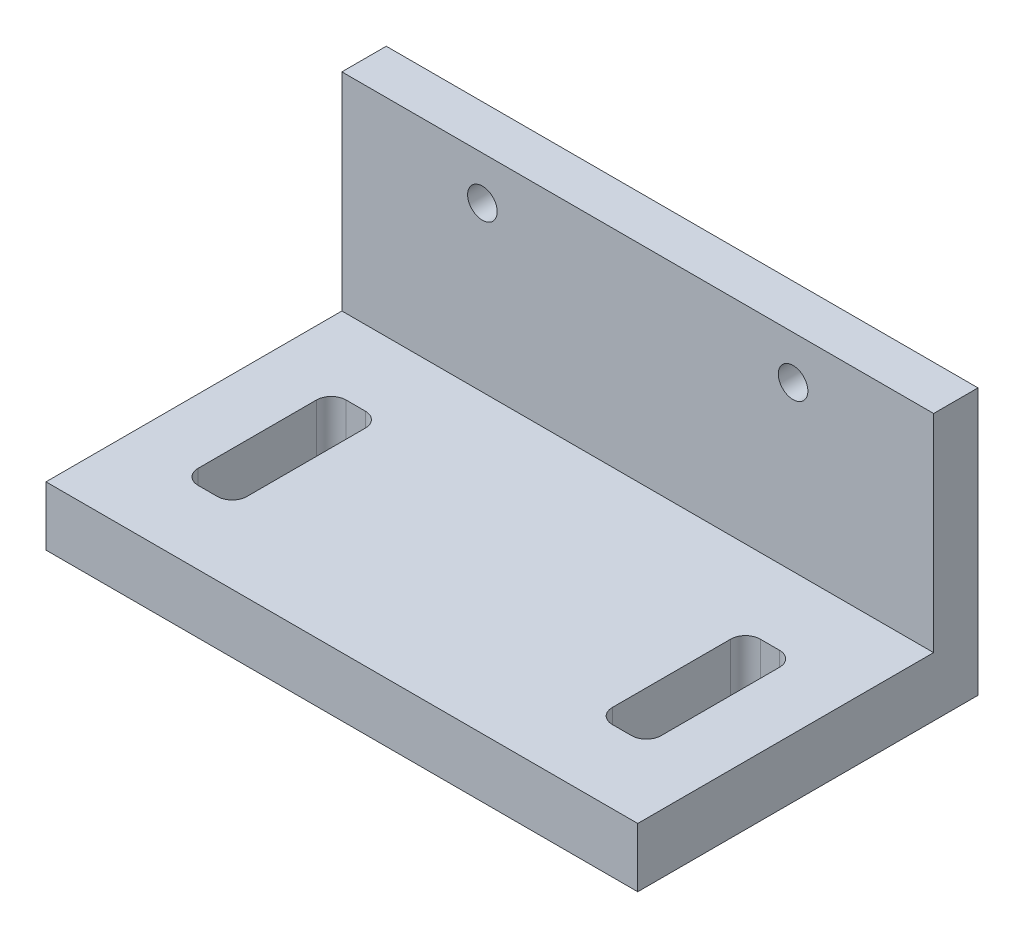
from build123d import *

# Parameters (mm, degrees)
SKETCH1_W           = 40
SKETCH1_H           = 20
BOSS_EXTRUDE1_DEPTH = 4
SKETCH2_W           = 40
SKETCH2_H           = 3
BOSS_EXTRUDE2_DEPTH = 18
SKETCH3_R           = 1
CUT_EXTRUDE1_DEPTH  = 36.397740041


with BuildPart() as part:
    # Sketch1 → Boss-Extrude1 (new body)
    with BuildSketch(Plane(origin=(0, 0, 0), x_dir=(1, 0, 0), z_dir=(0, 1, 0))):
        Rectangle(SKETCH1_W, SKETCH1_H)
        with BuildLine():
            Line((13.35, 4.93188921), (14.65, 4.93188921))
            ThreePointArc((14.65, 4.93188921), (15.357106781, 4.638995992), (15.65, 3.93188921))
            Line((15.65, 3.93188921), (15.65, -4.06811079))
            ThreePointArc((15.65, -4.06811079), (15.357106781, -4.775217571), (14.65, -5.06811079))
            Line((14.65, -5.06811079), (13.35, -5.06811079))
            ThreePointArc((13.35, -5.06811079), (12.642893219, -4.775217571), (12.35, -4.06811079))
            Line((12.35, -4.06811079), (12.35, 3.93188921))
            ThreePointArc((12.35, 3.93188921), (12.642893219, 4.638995992), (13.35, 4.93188921))
        make_face(mode=Mode.SUBTRACT)
        with BuildLine():
            Line((-15.65, 3.93188921), (-15.65, -4.06811079))
            ThreePointArc((-15.65, -4.06811079), (-15.357106781, -4.775217571), (-14.65, -5.06811079))
            Line((-14.65, -5.06811079), (-13.35, -5.06811079))
            ThreePointArc((-13.35, -5.06811079), (-12.642893219, -4.775217571), (-12.35, -4.06811079))
            Line((-12.35, -4.06811079), (-12.35, 3.93188921))
            ThreePointArc((-12.35, 3.93188921), (-12.642893219, 4.638995992), (-13.35, 4.93188921))
            Line((-13.35, 4.93188921), (-14.65, 4.93188921))
            ThreePointArc((-14.65, 4.93188921), (-15.357106781, 4.638995992), (-15.65, 3.93188921))
        make_face(mode=Mode.SUBTRACT)
    extrude(amount=BOSS_EXTRUDE1_DEPTH)

    # Sketch2 → Boss-Extrude2 (add)
    with BuildSketch(Plane(origin=(0, 0, 0), x_dir=(1, 0, 0), z_dir=(0, 1, 0))):
        with Locations((0, 11.5)):
            Rectangle(SKETCH2_W, SKETCH2_H)
    extrude(amount=BOSS_EXTRUDE2_DEPTH)

    # Sketch3 → Cut-Extrude1 (cut, through all)
    with BuildSketch(Plane(origin=(0, 0, -13), x_dir=(-1, 0, 0), z_dir=(0, 0, -1))):
        with Locations((10.5, 15.063230043)):
            Circle(SKETCH3_R)
        with Locations((-10.5, 15.063230043)):
            Circle(SKETCH3_R)
    extrude(amount=-CUT_EXTRUDE1_DEPTH, mode=Mode.SUBTRACT)


solid = part.part
